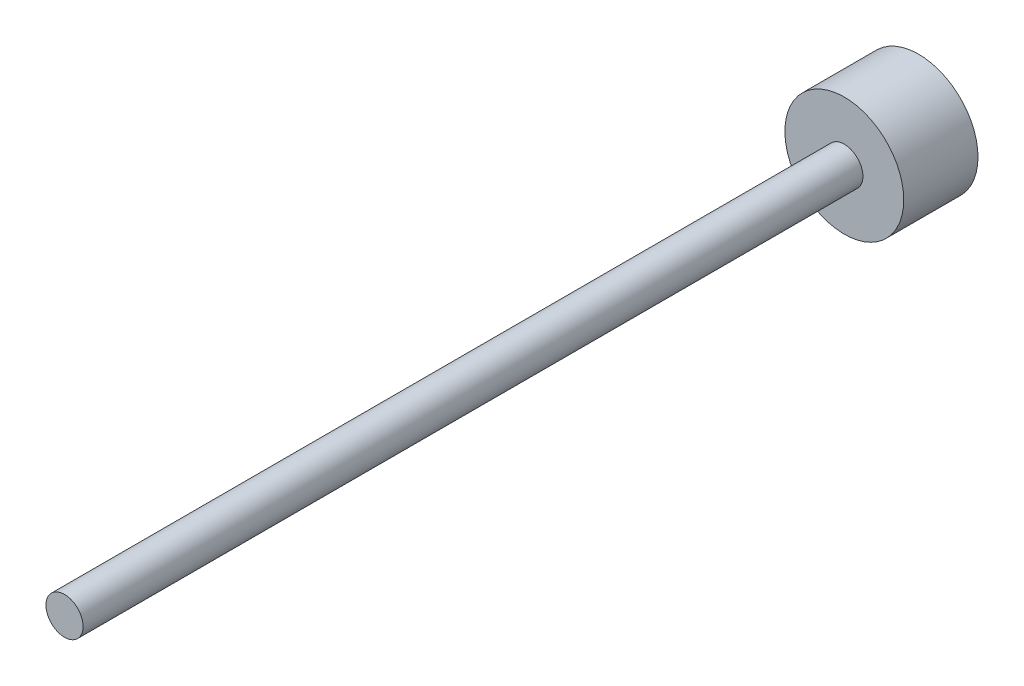
from build123d import *

# Parameters (mm, degrees)
SKETCH_1_R      = 8
EXTRUDE_1_DEPTH = 10
SKETCH_2_R      = 2.5
EXTRUDE_2_DEPTH = 105


with BuildPart() as part:
    # 草图1 → 凸台-拉伸1 (new body)
    with BuildSketch(Plane.XY):
        Circle(SKETCH_1_R)
    extrude(amount=EXTRUDE_1_DEPTH)

    # 草图2 → 凸台-拉伸2 (add)
    with BuildSketch(Plane.XY.offset(10)):
        Circle(SKETCH_2_R)
    extrude(amount=EXTRUDE_2_DEPTH)


solid = part.part
